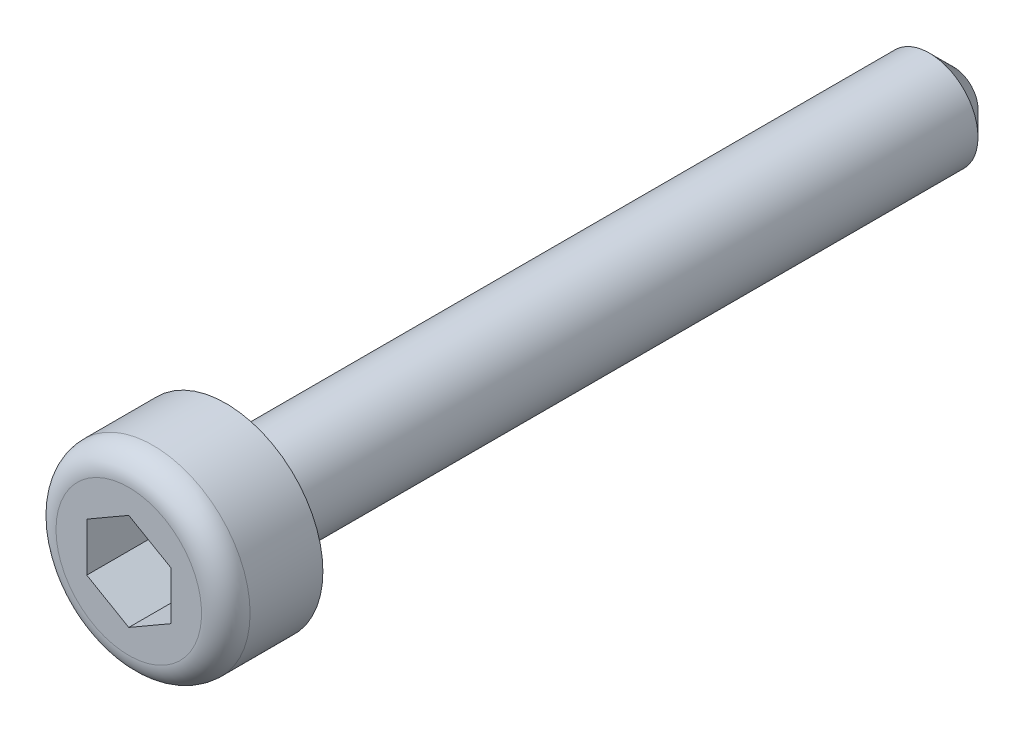
from build123d import *

# Parameters (mm, degrees)
FOOTPRINT_DEPTH = 3
CHAMFER1_SIZE   = 1
FILLET1_R       = 1


with BuildPart() as part:
    # Sketch1 → Body (revolve)
    with BuildSketch(Plane(origin=(0, 0, 0), x_dir=(0, 0, -1), z_dir=(1, 0, 0)), mode=Mode.PRIVATE) as body_sk:
        Polygon((0, 0), (0, 4), (4, 4), (4, 2), (34, 2), (34, 0), align=None)
    revolve(body_sk.sketch.rotate(Axis((0, 0, 156.291575099), (0, 0, -1)), 90), axis=Axis((0, 0, 156.291575099), (0, 0, -1)))

    # Sketch2 → Footprint (cut)
    with BuildSketch(Plane.XY):
        Polygon((0, 2), (-1.732050808, 1), (-1.732050808, -1), (0, -2), (1.732050808, -1), (1.732050808, 1), align=None)
    extrude(amount=-FOOTPRINT_DEPTH, mode=Mode.SUBTRACT)

    # Chamfer1
    chamfer1_edges = [part.edges().sort_by_distance(p)[0] for p in [
        (-2, 0, -34),
    ]]
    chamfer(chamfer1_edges, length=CHAMFER1_SIZE)

    # Fillet1
    fillet1_edges = [part.edges().sort_by_distance(p)[0] for p in [
        (-4, 0, 0),
    ]]
    fillet(fillet1_edges, radius=FILLET1_R)


solid = part.part
